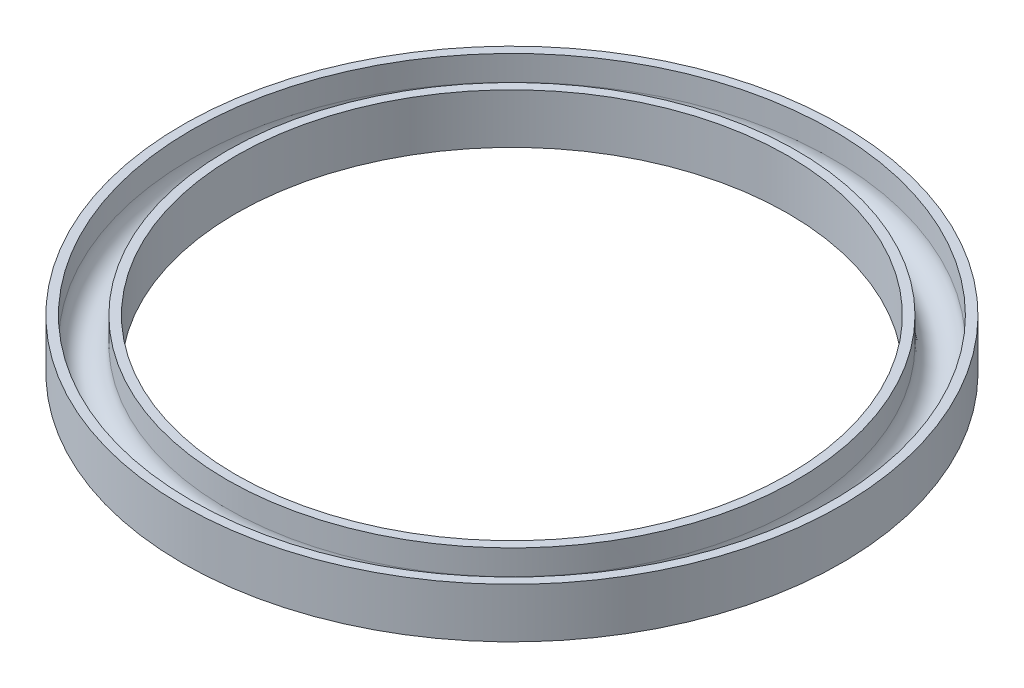
from build123d import *

# Parameters (mm, degrees)
SKETCH_1_R      = 90
SKETCH_1_R_2    = 80
EXTRUDE_1_DEPTH = 7
SKETCH_1_3_R    = 92.5
SKETCH_1_3_R_2  = 90
SKETCH_1_3_R_3  = 80
SKETCH_1_3_R_4  = 77.5
EXTRUDE_2_DEPTH = 14


with BuildPart() as part:
    # 草图1 → 凸台-拉伸1 (new body)
    with BuildSketch(Plane(origin=(0, 0, 0), x_dir=(1, 0, 0), z_dir=(0, 1, 0))):
        Circle(SKETCH_1_R)
        Circle(SKETCH_1_R_2, mode=Mode.SUBTRACT)
    extrude(amount=EXTRUDE_1_DEPTH)

    # 草图1<3> → 凸台-拉伸2 (add)
    # profile 1 of 2: a face of its own
    with BuildSketch(Plane(origin=(0, 0, 0), x_dir=(1, 0, 0), z_dir=(0, 1, 0))):
        Circle(SKETCH_1_3_R)
        Circle(SKETCH_1_3_R_2, mode=Mode.SUBTRACT)
    # profile 2 of 2: a face of its own
    with BuildSketch(Plane(origin=(0, 0, 0), x_dir=(1, 0, 0), z_dir=(0, 1, 0))):
        Circle(SKETCH_1_3_R_3)
        Circle(SKETCH_1_3_R_4, mode=Mode.SUBTRACT)
    extrude(amount=EXTRUDE_2_DEPTH)

    # 切除-扫描1: sweep along a path in 草图3
    with BuildLine(Plane(origin=(0, 7, 0), x_dir=(1, 0, 0), z_dir=(0, 1, 0))) as sweep_1_path:
        CenterArc((0, 0), 85, 0, 360)
    # 草图2 → 切除-扫描1 (sweep, cut)
    with BuildSketch(Plane.XY):
        with BuildLine():
            Line((-90, 7), (-80, 7))
            ThreePointArc((-80, 7), (-85, 2), (-90, 7))
        make_face()
    sweep(path=sweep_1_path.line, mode=Mode.SUBTRACT)


solid = part.part
